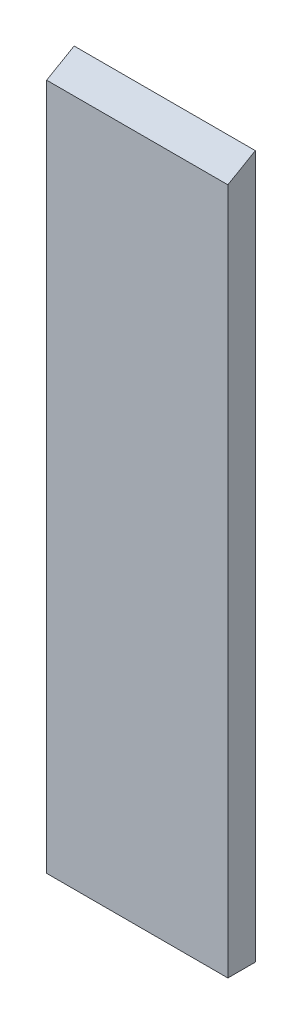
from build123d import *

# Parameters (mm, degrees)
CROQUIS1_W              = 200
CROQUIS1_H              = 30.31
SALIENTE_EXTRUIR1_DEPTH = 775.633
CORTAR_EXTRUIR1_DEPTH   = 360


with BuildPart() as part:
    # Croquis1 → Saliente-Extruir1 (new body)
    with BuildSketch(Plane(origin=(0, 0, 0), x_dir=(1, 0, 0), z_dir=(0, 1, 0))):
        with Locations((90.078125, 29.522734375)):
            Rectangle(CROQUIS1_W, CROQUIS1_H)
    extrude(amount=SALIENTE_EXTRUIR1_DEPTH)

    # Croquis5 → Cortar-Extruir1 (cut)
    with BuildSketch(Plane(origin=(190.078125, 0, 0), x_dir=(0, 0, -1), z_dir=(1, 0, 0))):
        Polygon((14.367734375, 775.633), (44.677734375, 775.633), (14.367734375, 758.131460068), align=None)
    extrude(amount=-CORTAR_EXTRUIR1_DEPTH, mode=Mode.SUBTRACT)


solid = part.part
